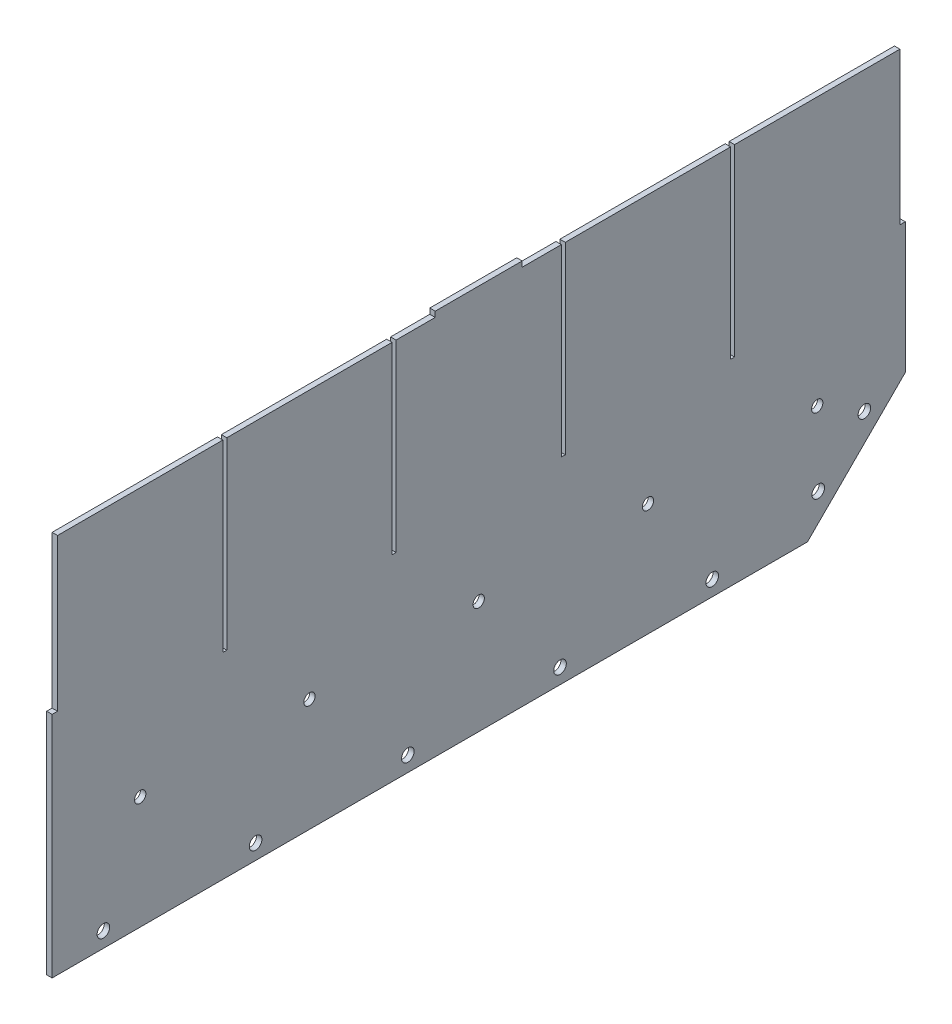
from build123d import *

# Parameters (mm, degrees)
SKETCH1_W            = 498.348
SKETCH1_H            = 165.1
BOSS_EXTRUDE1_DEPTH  = 1.5875
BOSS_EXTRUDE2_DEPTH  = 3.175
CUT_EXTRUDE1_DEPTH   = 3.175
LPATTERN1_COUNT      = 5
LPATTERN1_PITCH      = 88.9
SKETCH4_R            = 3.675
CUT_EXTRUDE2_DEPTH   = 286.681383539
LPATTERN2_COUNT      = 2
LPATTERN2_PITCH      = 38.1
SKETCH5_W            = 3.175
SKETCH5_H            = 88.9
CUT_EXTRUDE3_DEPTH   = 286.681383539
SKETCH6_W            = 2.286
SKETCH6_H            = 107.442
CUT_EXTRUDE4_DEPTH   = 286.681383539
LPATTERN3_COUNT      = 4
LPATTERN3_PITCH      = 98.8568
SKETCH7_W            = 50.8
SKETCH7_H            = 3.175
BOSS_EXTRUDE3_DEPTH  = 3.175
M6_CLEARANCE_HOLE1_D = 6.6
LPATTERN4_COUNT      = 3
LPATTERN4_PITCH      = 98.8568
LPATTERN4_COL_COUNT  = 3
LPATTERN4_COL_PITCH  = 98.8568


with BuildPart() as part:
    # Sketch1 → Boss-Extrude1 (new, symmetric)
    with BuildSketch(Plane(origin=(0, 0, 0), x_dir=(0, 0, -1), z_dir=(1, 0, 0))):
        Rectangle(SKETCH1_W, SKETCH1_H)
    extrude(amount=BOSS_EXTRUDE1_DEPTH, both=True)

    # Sketch2 → Boss-Extrude2 (add)
    with BuildSketch(Plane(origin=(1.5875, 0, 0), x_dir=(0, 0, -1), z_dir=(1, 0, 0))):
        Polygon((-249.174, -139.7), (192.024, -139.7), (249.174, -82.55), (-249.174, -82.55), align=None)
    extrude(amount=-BOSS_EXTRUDE2_DEPTH)

    # Sketch3 → Cut-Extrude1 (cut)
    with BuildSketch(Plane(origin=(1.5875, 0, 0), x_dir=(0, 0, -1), z_dir=(1, 0, 0))):
        with BuildLine():
            ThreePointArc((-222.877, -130.81), (-221.800617421, -133.408617421), (-219.202, -134.485))
            Line((-219.202, -134.485), (-219.202, -130.81))
            Line((-219.202, -130.81), (-222.877, -130.81))
        make_face()
        with BuildLine():
            Line((-219.202, -130.81), (-219.202, -134.485))
            ThreePointArc((-219.202, -134.485), (-216.603382579, -133.408617421), (-215.527, -130.81))
            ThreePointArc((-215.527, -130.81), (-219.202, -127.135), (-222.877, -130.81))
            Line((-222.877, -130.81), (-219.202, -130.81))
        make_face()
    cut_extrude1 = extrude(amount=-CUT_EXTRUDE1_DEPTH, mode=Mode.SUBTRACT)

    # LPattern1: Cut-Extrude1 ×5
    with Locations(*[(0, 0, -i * LPATTERN1_PITCH) for i in range(1, LPATTERN1_COUNT)]):
        add(cut_extrude1, mode=Mode.SUBTRACT)

    # Sketch4 → Cut-Extrude2 (cut, through all)
    with BuildSketch(Plane(origin=(1.5875, 0, 0), x_dir=(0, 0, -1), z_dir=(1, 0, 0))):
        with Locations((198.310179285, -117.249359697)):
            Circle(SKETCH4_R)
    cut_extrude2 = extrude(amount=-CUT_EXTRUDE2_DEPTH, mode=Mode.SUBTRACT)

    # LPattern2: Cut-Extrude2 ×2
    with Locations(*[Vector(0, 0.7071067811865488, -0.7071067811865462) * (i * LPATTERN2_PITCH) for i in range(1, LPATTERN2_COUNT)]):
        add(cut_extrude2, mode=Mode.SUBTRACT)

    # Sketch5 → Cut-Extrude3 (cut, through all)
    with BuildSketch(Plane.ZY.offset(1.5875)):
        with Locations((-247.5865, 38.1)):
            Rectangle(SKETCH5_W, SKETCH5_H)
        with Locations((247.5865, 38.1)):
            Rectangle(SKETCH5_W, SKETCH5_H)
    extrude(amount=-CUT_EXTRUDE3_DEPTH, mode=Mode.SUBTRACT)

    # Sketch6 → Cut-Extrude4 (cut, through all)
    with BuildSketch(Plane.ZY.offset(1.5875)):
        with Locations((-148.2852, 28.829)):
            Rectangle(SKETCH6_W, SKETCH6_H)
    cut_extrude4 = extrude(amount=-CUT_EXTRUDE4_DEPTH, mode=Mode.SUBTRACT)

    # LPattern3: Cut-Extrude4 ×4
    with Locations(*[(0, 0, i * LPATTERN3_PITCH) for i in range(1, LPATTERN3_COUNT)]):
        add(cut_extrude4, mode=Mode.SUBTRACT)

    # Sketch7 → Boss-Extrude3 (add)
    with BuildSketch(Plane.ZY.offset(1.5875)):
        with Locations((0, 84.1375)):
            Rectangle(SKETCH7_W, SKETCH7_H)
    extrude(amount=-BOSS_EXTRUDE3_DEPTH)

    # M6 Clearance Hole1 (through all)
    with Locations(Plane(origin=(1.5875, 0, 0), x_dir=(0, 0, -1), z_dir=(1, 0, 0))):
        with Locations((0, -73.8124)):
            m6_clearance_hole1 = Hole(M6_CLEARANCE_HOLE1_D / 2)

    # LPattern4: M6 Clearance Hole1 ×3
    with Locations(*[(0, 0, i * LPATTERN4_PITCH) for i in range(1, LPATTERN4_COUNT)]):
        add(m6_clearance_hole1, mode=Mode.SUBTRACT)

    # LPattern4 col: M6 Clearance Hole1 ×3
    with Locations(*[(0, 0, -i * LPATTERN4_COL_PITCH) for i in range(1, LPATTERN4_COL_COUNT)]):
        add(m6_clearance_hole1, mode=Mode.SUBTRACT)


solid = part.part
